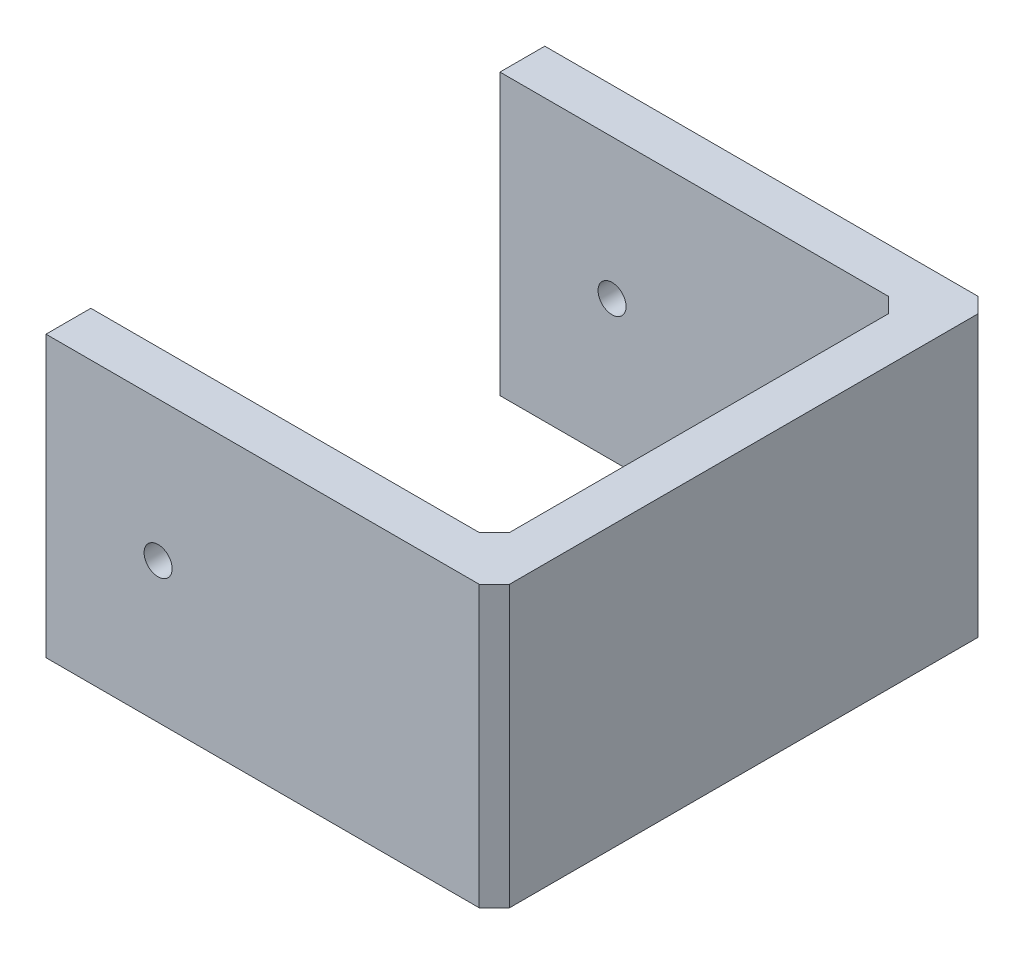
from build123d import *

# Parameters (mm, degrees)
BOSS_EXTRUDE2_DEPTH = 25
SKETCH6_R           = 1.25
CUT_EXTRUDE1_DEPTH  = 65.847898964


with BuildPart() as part:
    # Sketch3 → Boss-Extrude2 (new body)
    with BuildSketch(Plane(origin=(0, 0, 0), x_dir=(1, 0, 0), z_dir=(0, 1, 0))):
        Polygon((0, 18.25), (0, 22.25), (38.64701272, 22.25), (40, 20.89701272), (40, -20.89701272), (38.64701272, -22.25), (0, -22.25), (0, -18.25), (34.64701272, -18.25), (36, -16.89701272), (36, 16.89701272), (34.64701272, 18.25), align=None)
    extrude(amount=BOSS_EXTRUDE2_DEPTH)

    # Sketch6 → Cut-Extrude1 (cut, through all)
    with BuildSketch(Plane.XY.offset(22.25)):
        with Locations((10, 12.5)):
            Circle(SKETCH6_R)
    extrude(amount=-CUT_EXTRUDE1_DEPTH, mode=Mode.SUBTRACT)


solid = part.part
